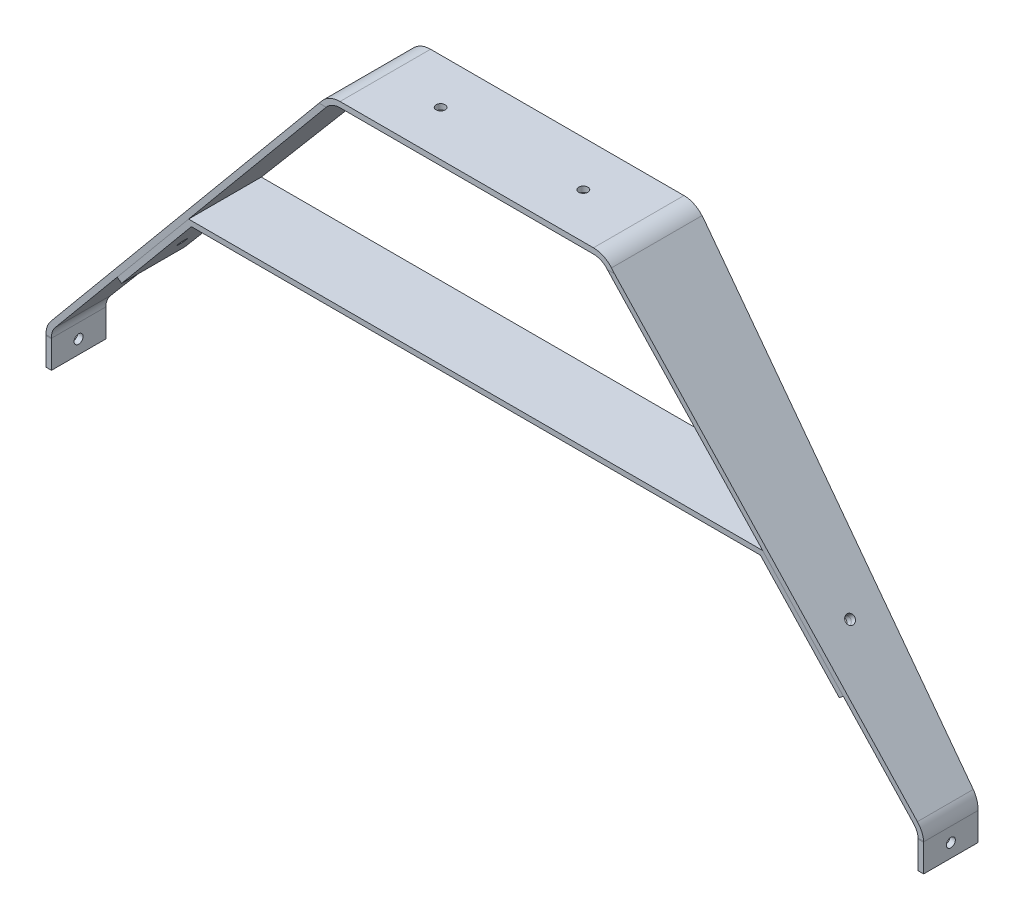
from build123d import *

# Parameters (mm, degrees)
BOSS_EXTRUDE1_DEPTH     = 25
CUT_EXTRUDE1_DEPTH      = 275.690504759
SKETCH6_R               = 2.5
CUT_EXTRUDE3_DEPTH      = 326.011433764
SKETCH7_R               = 2.5
CUT_EXTRUDE4_DEPTH      = 275.690504819
BOSS_EXTRUDE2_DEPTH     = 50
CUT_EXTRUDE5_DEPTH      = 530.616103216
CUT_EXTRUDE5_DEPTH_BACK = 530.616103216
SKETCH11_R              = 2.5
CUT_EXTRUDE6_DEPTH      = 534.660292369


with BuildPart() as part:
    # Sketch2 → Boss-Extrude1 (new, symmetric)
    with BuildSketch(Plane.XY):
        with BuildLine():
            Line((0, 0), (0, 15.360297657))
            ThreePointArc((0, 15.360297657), (0.603073792, 18.780499091), (2.339555569, 21.788173754))
            Line((2.339555569, 21.788173754), (161.768485492, 211.788173754))
            ThreePointArc((161.768485492, 211.788173754), (165.202747306, 214.423375528), (169.428929924, 215.360297657))
            Line((169.428929924, 215.360297657), (239.428929924, 215.360297657))
            Line((239.428929924, 215.360297657), (239.428929924, 218.360297657))
            Line((239.428929924, 218.360297657), (169.428929924, 218.360297657))
            ThreePointArc((169.428929924, 218.360297657), (163.934892521, 217.142298889), (159.470352163, 213.716536583))
            Line((159.470352163, 213.716536583), (0.041422239, 23.716536583))
            ThreePointArc((0.041422239, 23.716536583), (-2.21600407, 19.806559521), (-3, 15.360297657))
            Line((-3, 15.360297657), (-3, 0))
            Line((-3, 0), (0, 0))
        make_face()
    boss_extrude1 = extrude(amount=BOSS_EXTRUDE1_DEPTH, both=True)

    # Sketch3 → Cut-Extrude1 (cut, symmetric)
    with BuildSketch(Plane(origin=(161.768485492, 0, 0), x_dir=(0, 0, -1), z_dir=(1, 0, 0))):
        with BuildLine():
            Line((25, 211.788173754), (25, 15.360297657))
            Line((25, 15.360297657), (25, 0))
            Line((25, 0), (15, 0))
            Line((15, 0), (15, 15.105916019))
            ThreePointArc((15, 15.105916019), (15.003233931, 15.360215392), (15.012933634, 15.614350288))
            Line((15.012933634, 15.614350288), (25, 211.788173754))
        make_face()
        with BuildLine():
            Line((-25, 211.788173754), (-25, 15.360297657))
            Line((-25, 15.360297657), (-25, 0))
            Line((-25, 0), (-15, 0))
            Line((-15, 0), (-15, 15.105916019))
            ThreePointArc((-15, 15.105916019), (-15.003233931, 15.360215392), (-15.012933634, 15.614350288))
            Line((-15.012933634, 15.614350288), (-25, 211.788173754))
        make_face()
    cut_extrude1 = extrude(amount=CUT_EXTRUDE1_DEPTH, both=True, mode=Mode.SUBTRACT)

    # Sketch6 → Cut-Extrude3 (cut, symmetric)
    with BuildSketch(Plane(origin=(0, 0, 0), x_dir=(1, 0, 0), z_dir=(0, 1, 0))):
        with Locations(Location((200, 0, 0), (0, 0, 270))):
            Circle(SKETCH6_R)
    cut_extrude3 = extrude(amount=CUT_EXTRUDE3_DEPTH, both=True, mode=Mode.SUBTRACT)

    # Sketch7 → Cut-Extrude4 (cut, symmetric)
    with BuildSketch(Plane(origin=(161.768485492, 0, 0), x_dir=(0, 0, -1), z_dir=(1, 0, 0))):
        with Locations((0, 7.5)):
            Circle(SKETCH7_R)
    cut_extrude4 = extrude(amount=CUT_EXTRUDE4_DEPTH, both=True, mode=Mode.SUBTRACT)

    # Mirror2: Boss-Extrude1, Cut-Extrude1, Cut-Extrude3, Cut-Extrude4 across plane
    add(boss_extrude1.mirror(Plane(origin=(239.428929924, 218.360297657, 25), x_dir=(0, 0, 1), z_dir=(-1, 0, 0))))
    add(cut_extrude1.mirror(Plane(origin=(239.428929924, 218.360297657, 25), x_dir=(0, 0, 1), z_dir=(-1, 0, 0))), mode=Mode.SUBTRACT)
    add(cut_extrude3.mirror(Plane(origin=(239.428929924, 218.360297657, 25), x_dir=(0, 0, 1), z_dir=(-1, 0, 0))), mode=Mode.SUBTRACT)
    add(cut_extrude4.mirror(Plane(origin=(239.428929924, 218.360297657, 25), x_dir=(0, 0, 1), z_dir=(-1, 0, 0))), mode=Mode.SUBTRACT)


with BuildPart() as body_2:
    # Sketch9 → Boss-Extrude2 (new body)
    with BuildSketch(Plane.XY.offset(25)):
        Polygon((80.855890224, 115.360297657), (398.001969623, 115.360297657), (439.956951182, 65.360297657), (437.658817852, 63.431934828), (396.603046648, 112.360297657), (82.254813199, 112.360297657), (41.199041995, 63.431934828), (38.900908666, 65.360297657), align=None)
    extrude(amount=-BOSS_EXTRUDE2_DEPTH)

    # Sketch10 → Cut-Extrude5 (cut, two sides: drawn at the far end of the back side and taken through both)
    with BuildSketch(Plane(origin=(0, 0, 0), x_dir=(0, 0, -1), z_dir=(1, 0, 0)).offset(-CUT_EXTRUDE5_DEPTH_BACK)):
        Polygon((25, 115.360297657), (20.090927112, 115.360297657), (17.44729201, 63.431934828), (25, 63.431934828), align=None)
        Polygon((-17.44729201, 63.431934828), (-25, 63.431934828), (-25, 115.360297657), (-20.090927112, 115.360297657), align=None)
    extrude(amount=CUT_EXTRUDE5_DEPTH + CUT_EXTRUDE5_DEPTH_BACK, mode=Mode.SUBTRACT)


with BuildPart() as cut_extrude6_tool:
    # Sketch11 → Cut-Extrude6 (new, symmetric)
    with BuildSketch(Plane(origin=(-7.057540324, 5.921979483, 0), x_dir=(0, 0, -1), z_dir=(0.7660444431189791, -0.6427876096865379, 0))):
        with Locations(Location((0, 100.073914917, 0), (0, 0, 90))):
            Circle(SKETCH11_R)
    cut_extrude6 = extrude(amount=CUT_EXTRUDE6_DEPTH, both=True)


with BuildPart() as part_1:
    add(part.part)

    # Cut-Extrude6: cut by cut_extrude6_tool
    add(cut_extrude6_tool.part, mode=Mode.SUBTRACT)


with BuildPart() as body_2_1:
    add(body_2.part)

    # Cut-Extrude6: cut by cut_extrude6_tool
    add(cut_extrude6_tool.part, mode=Mode.SUBTRACT)


with BuildPart() as mirror3_tool:
    # Mirror3: Cut-Extrude6 across plane
    add(cut_extrude6.mirror(Plane(origin=(239.428929924, 0, 0), x_dir=(0, 0, 1), z_dir=(1, 0, 0))))


with BuildPart() as part_2:
    add(part_1.part)

    # Mirror3: cut by mirror3_tool
    add(mirror3_tool.part, mode=Mode.SUBTRACT)


with BuildPart() as body_2_2:
    add(body_2_1.part)

    # Mirror3: cut by mirror3_tool
    add(mirror3_tool.part, mode=Mode.SUBTRACT)


solid = Compound([part_2.part, body_2_2.part])
